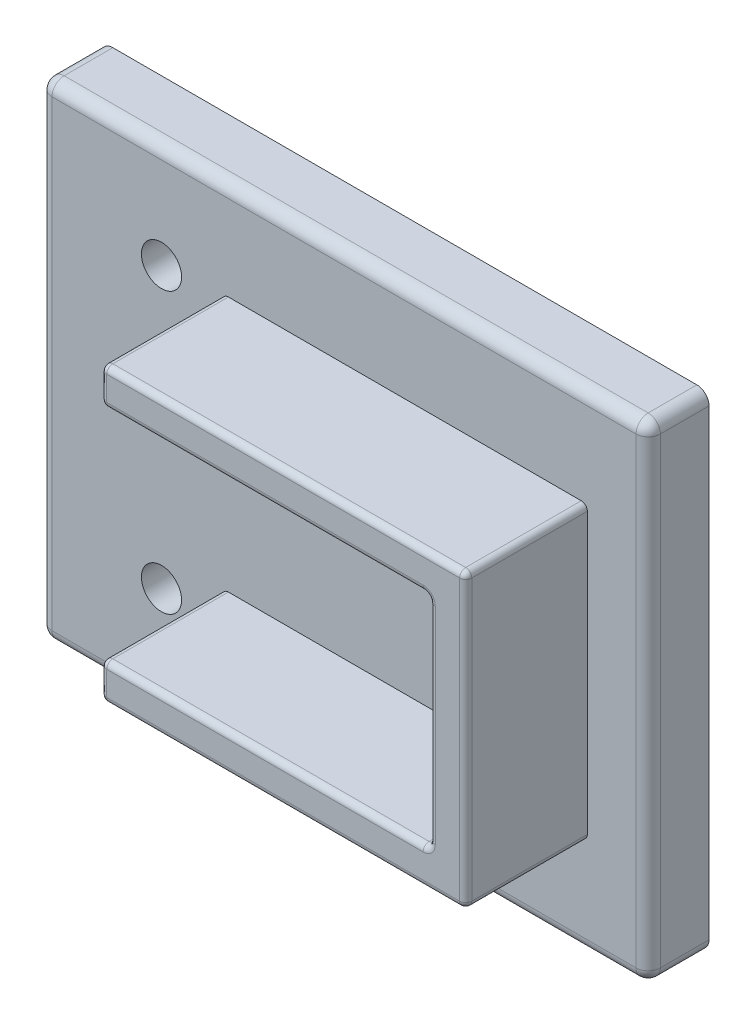
from build123d import *

# Parameters (mm, degrees)
SKETCH_2_W          = 50
SKETCH_2_H          = 40
EXTRUDE_1_DEPTH     = 5
EXTRUDE_START       = -8
SKETCH_5_W          = 30
SKETCH_5_H          = 10
EXTRUDE_2_DEPTH     = 3
SKETCH_6_W          = 30
SKETCH_6_H          = 10
EXTRUDE_3_DEPTH     = 3
CUT_EXTRUDE_1_REACH = 86.906
SKETCH_7_R          = 1.65
FILLET_3_R          = 1
SKETCH_8_W          = 10
SKETCH_8_H          = 21
EXTRUDE_4_DEPTH     = 3
FILLET_4_R          = 0.5


with BuildPart() as part:
    # 草图2 → 凸台-拉伸1 (new body)
    with BuildSketch(Plane.XY):
        with Locations((53, 10)):
            Rectangle(SKETCH_2_W, SKETCH_2_H)
    extrude(amount=EXTRUDE_1_DEPTH)

    # 草图5 → 凸台-拉伸2 (add)
    with BuildSketch(Plane.XZ.offset(10).offset(EXTRUDE_START)):
        with Locations((58, 10)):
            Rectangle(SKETCH_5_W, SKETCH_5_H)
    extrude(amount=-EXTRUDE_2_DEPTH)

    # 草图6 → 凸台-拉伸3 (add)
    with BuildSketch(Plane(origin=(0, 30, 0), x_dir=(1, 0, 0), z_dir=(0, 1, 0)).offset(EXTRUDE_START)):
        with Locations((58, -10)):
            Rectangle(SKETCH_6_W, SKETCH_6_H)
    extrude(amount=-EXTRUDE_3_DEPTH)

    # 草图7 → 切除-拉伸1 (cut, up to next)
    with BuildSketch(Plane(origin=(0, 0, 0), x_dir=(-1, 0, 0), z_dir=(0, 0, -1)), mode=Mode.PRIVATE) as cut_extrude_1_sk1:
        with Locations((-63, 10)):
            Circle(SKETCH_7_R)
    cut_extrude_1_tool1 = extrude(cut_extrude_1_sk1.sketch, amount=-CUT_EXTRUDE_1_REACH, mode=Mode.PRIVATE) & part.part
    # 草图7 → 切除-拉伸1 (cut, up to next)
    with BuildSketch(Plane(origin=(0, 0, 0), x_dir=(-1, 0, 0), z_dir=(0, 0, -1)), mode=Mode.PRIVATE) as cut_extrude_1_sk2:
        with Locations((-38, -1.5)):
            Circle(SKETCH_7_R)
    cut_extrude_1_tool2 = extrude(cut_extrude_1_sk2.sketch, amount=-CUT_EXTRUDE_1_REACH, mode=Mode.PRIVATE) & part.part
    # 草图7 → 切除-拉伸1 (cut, up to next)
    with BuildSketch(Plane(origin=(0, 0, 0), x_dir=(-1, 0, 0), z_dir=(0, 0, -1)), mode=Mode.PRIVATE) as cut_extrude_1_sk3:
        with Locations((-38, 21.5)):
            Circle(SKETCH_7_R)
    cut_extrude_1_tool3 = extrude(cut_extrude_1_sk3.sketch, amount=-CUT_EXTRUDE_1_REACH, mode=Mode.PRIVATE) & part.part
    add(cut_extrude_1_tool1.solids().sort_by_distance((63, 10, 0))[0], mode=Mode.SUBTRACT)
    add(cut_extrude_1_tool2.solids().sort_by_distance((38, -1.5, 0))[0], mode=Mode.SUBTRACT)
    add(cut_extrude_1_tool3.solids().sort_by_distance((38, 21.5, 0))[0], mode=Mode.SUBTRACT)

    # 圆角3
    fillet_3_edges = [part.edges().sort_by_distance(p)[0] for p in [
        (28, 10, 5),
        (53, -10, 5),
        (78, 10, 5),
        (78, -10, 2.5),
        (28, -10, 2.5),
        (28, 30, 2.5),
        (78, 30, 2.5),
        (53, 30, 5),
    ]]
    fillet(fillet_3_edges, radius=FILLET_3_R)

    # 草图8 → 凸台-拉伸4 (add)
    with BuildSketch(Plane(origin=(73, 0, 0), x_dir=(0, 0, -1), z_dir=(1, 0, 0))):
        with Locations((-10, 8.5)):
            Rectangle(SKETCH_8_W, SKETCH_8_H)
    extrude(amount=-EXTRUDE_4_DEPTH)

    # 圆角4
    fillet_4_edges = [part.edges().sort_by_distance(p)[0] for p in [
        (43, 1, 10),
        (43, -0.5, 15),
        (73, 10, 15),
        (73, -2, 10),
        (58, -2, 15),
        (43, -2, 10),
        (56.5, 19, 15),
        (43, 19, 10),
        (43, 20.5, 15),
        (43, 22, 10),
        (58, 22, 15),
        (73, 22, 10),
        (56.5, 1, 15),
        (70, 10, 15),
        (70, 1, 10),
        (70, 19, 10),
    ]]
    fillet(fillet_4_edges, radius=FILLET_4_R)


solid = part.part
